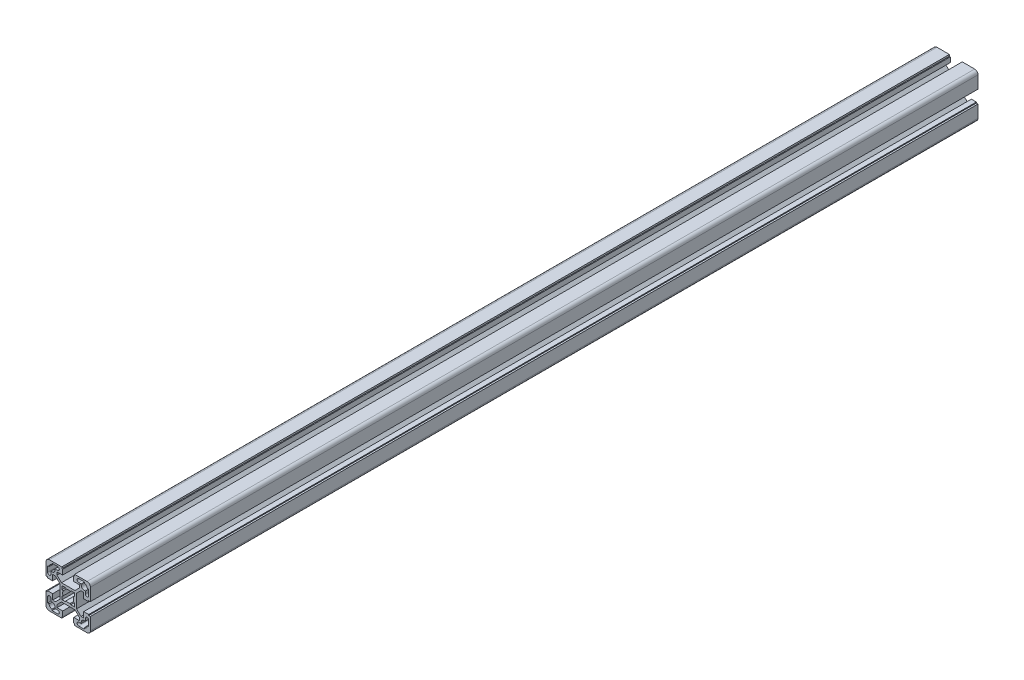
from build123d import *

# Parameters (mm, degrees)
EXTRUDE1_DEPTH = 800


with BuildPart() as part:
    # Sketch1 → Extrude1 (new body)
    with BuildSketch(Plane.XY):
        with BuildLine():
            Line((5.8, -20), (17, -20))
            ThreePointArc((17, -20), (19.121320344, -19.121320344), (20, -17))
            Line((20, -17), (20, -5.8))
            Line((20, -5.8), (18.5, -5.8))
            Line((18.5, -5.8), (18.5, -5))
            Line((18.5, -5), (14, -5))
            Line((14, -5), (14, -10.05))
            Line((14, -10.05), (11.464213562, -10.05))
            Line((11.464213562, -10.05), (7.5, -6.085786438))
            Line((7.5, -6.085786438), (7.5, 6.085786438))
            Line((7.5, 6.085786438), (11.464213562, 10.05))
            Line((11.464213562, 10.05), (14, 10.05))
            Line((14, 10.05), (14, 5))
            Line((14, 5), (18.5, 5))
            Line((18.5, 5), (18.5, 5.8))
            Line((18.5, 5.8), (20, 5.8))
            Line((20, 5.8), (20, 17))
            ThreePointArc((20, 17), (19.121320344, 19.121320344), (17, 20))
            Line((17, 20), (5.8, 20))
            Line((5.8, 20), (5.8, 18.5))
            Line((5.8, 18.5), (5, 18.5))
            Line((5, 18.5), (5, 14))
            Line((5, 14), (10.05, 14))
            Line((10.05, 14), (10.05, 11.464213562))
            Line((10.05, 11.464213562), (6.085786438, 7.5))
            Line((6.085786438, 7.5), (-6.085786438, 7.5))
            Line((-6.085786438, 7.5), (-10.05, 11.464213562))
            Line((-10.05, 11.464213562), (-10.05, 14))
            Line((-10.05, 14), (-5, 14))
            Line((-5, 14), (-5, 18.5))
            Line((-5, 18.5), (-5.8, 18.5))
            Line((-5.8, 18.5), (-5.8, 20))
            Line((-5.8, 20), (-17, 20))
            ThreePointArc((-17, 20), (-19.121320344, 19.121320344), (-20, 17))
            Line((-20, 17), (-20, 5.8))
            Line((-20, 5.8), (-18.5, 5.8))
            Line((-18.5, 5.8), (-18.5, 5))
            Line((-18.5, 5), (-14, 5))
            Line((-14, 5), (-14, 10.05))
            Line((-14, 10.05), (-11.464213562, 10.05))
            Line((-11.464213562, 10.05), (-7.5, 6.085786438))
            Line((-7.5, 6.085786438), (-7.5, -6.085786438))
            Line((-7.5, -6.085786438), (-11.464213562, -10.05))
            Line((-11.464213562, -10.05), (-14, -10.05))
            Line((-14, -10.05), (-14, -5))
            Line((-14, -5), (-18.5, -5))
            Line((-18.5, -5), (-18.5, -5.8))
            Line((-18.5, -5.8), (-20, -5.8))
            Line((-20, -5.8), (-20, -17))
            ThreePointArc((-20, -17), (-19.121320344, -19.121320344), (-17, -20))
            Line((-17, -20), (-5.8, -20))
            Line((-5.8, -20), (-5.8, -18.5))
            Line((-5.8, -18.5), (-5, -18.5))
            Line((-5, -18.5), (-5, -14))
            Line((-5, -14), (-10.05, -14))
            Line((-10.05, -14), (-10.05, -11.464213562))
            Line((-10.05, -11.464213562), (-6.085786438, -7.5))
            Line((-6.085786438, -7.5), (6.085786438, -7.5))
            Line((6.085786438, -7.5), (10.05, -11.464213562))
            Line((10.05, -11.464213562), (10.05, -14))
            Line((10.05, -14), (5, -14))
            Line((5, -14), (5, -18.5))
            Line((5, -18.5), (5.8, -18.5))
            Line((5.8, -18.5), (5.8, -20))
        make_face()
        with BuildLine():
            Line((14.5, -18.5), (9.5, -18.5))
            ThreePointArc((9.5, -18.5), (8, -17), (9.5, -15.5))
            Line((9.5, -15.5), (11.75, -15.5))
            Line((11.75, -15.5), (11.75, -14.5))
            ThreePointArc((11.75, -14.5), (12.555456352, -12.555456352), (14.5, -11.75))
            Line((14.5, -11.75), (15.5, -11.75))
            Line((15.5, -11.75), (15.5, -9.5))
            ThreePointArc((15.5, -9.5), (17, -8), (18.5, -9.5))
            Line((18.5, -9.5), (18.5, -14.5))
            Line((18.5, -14.5), (17.25, -14.5))
            ThreePointArc((17.25, -14.5), (16.444543648, -16.444543648), (14.5, -17.25))
            Line((14.5, -17.25), (14.5, -18.5))
        make_face(mode=Mode.SUBTRACT)
        with BuildLine():
            Line((18.5, 14.5), (17.25, 14.5))
            ThreePointArc((17.25, 14.5), (16.444543648, 16.444543648), (14.5, 17.25))
            Line((14.5, 17.25), (14.5, 18.5))
            Line((14.5, 18.5), (9.5, 18.5))
            ThreePointArc((9.5, 18.5), (8, 17), (9.5, 15.5))
            Line((9.5, 15.5), (11.75, 15.5))
            Line((11.75, 15.5), (11.75, 14.5))
            ThreePointArc((11.75, 14.5), (12.555456352, 12.555456352), (14.5, 11.75))
            Line((14.5, 11.75), (15.5, 11.75))
            Line((15.5, 11.75), (15.5, 9.5))
            ThreePointArc((15.5, 9.5), (17, 8), (18.5, 9.5))
            Line((18.5, 9.5), (18.5, 14.5))
        make_face(mode=Mode.SUBTRACT)
        with BuildLine():
            Line((5.5, 5.5), (2.397915762, 5.5))
            Line((2.397915762, 5.5), (1.998263135, 4.583333333))
            ThreePointArc((1.998263135, 4.583333333), (0, 5), (-1.998263135, 4.583333333))
            Line((-1.998263135, 4.583333333), (-2.397915762, 5.5))
            Line((-2.397915762, 5.5), (-5.5, 5.5))
            Line((-5.5, 5.5), (-5.5, 2.397915762))
            Line((-5.5, 2.397915762), (-4.583333333, 1.998263135))
            ThreePointArc((-4.583333333, 1.998263135), (-5, 0), (-4.583333333, -1.998263135))
            Line((-4.583333333, -1.998263135), (-5.5, -2.397915762))
            Line((-5.5, -2.397915762), (-5.5, -5.5))
            Line((-5.5, -5.5), (-2.397915762, -5.5))
            Line((-2.397915762, -5.5), (-1.998263135, -4.583333333))
            ThreePointArc((-1.998263135, -4.583333333), (0, -5), (1.998263135, -4.583333333))
            Line((1.998263135, -4.583333333), (2.397915762, -5.5))
            Line((2.397915762, -5.5), (5.5, -5.5))
            Line((5.5, -5.5), (5.5, -2.397915762))
            Line((5.5, -2.397915762), (4.583333333, -1.998263135))
            ThreePointArc((4.583333333, -1.998263135), (5, 0), (4.583333333, 1.998263135))
            Line((4.583333333, 1.998263135), (5.5, 2.397915762))
            Line((5.5, 2.397915762), (5.5, 5.5))
        make_face(mode=Mode.SUBTRACT)
        with BuildLine():
            Line((-18.5, -14.5), (-17.25, -14.5))
            ThreePointArc((-17.25, -14.5), (-16.444543648, -16.444543648), (-14.5, -17.25))
            Line((-14.5, -17.25), (-14.5, -18.5))
            Line((-14.5, -18.5), (-9.5, -18.5))
            ThreePointArc((-9.5, -18.5), (-8, -17), (-9.5, -15.5))
            Line((-9.5, -15.5), (-11.75, -15.5))
            Line((-11.75, -15.5), (-11.75, -14.5))
            ThreePointArc((-11.75, -14.5), (-12.555456352, -12.555456352), (-14.5, -11.75))
            Line((-14.5, -11.75), (-15.5, -11.75))
            Line((-15.5, -11.75), (-15.5, -9.5))
            ThreePointArc((-15.5, -9.5), (-17, -8), (-18.5, -9.5))
            Line((-18.5, -9.5), (-18.5, -14.5))
        make_face(mode=Mode.SUBTRACT)
        with BuildLine():
            Line((-14.5, 18.5), (-9.5, 18.5))
            ThreePointArc((-9.5, 18.5), (-8, 17), (-9.5, 15.5))
            Line((-9.5, 15.5), (-11.75, 15.5))
            Line((-11.75, 15.5), (-11.75, 14.5))
            ThreePointArc((-11.75, 14.5), (-12.555456352, 12.555456352), (-14.5, 11.75))
            Line((-14.5, 11.75), (-15.5, 11.75))
            Line((-15.5, 11.75), (-15.5, 9.5))
            ThreePointArc((-15.5, 9.5), (-17, 8), (-18.5, 9.5))
            Line((-18.5, 9.5), (-18.5, 14.5))
            Line((-18.5, 14.5), (-17.25, 14.5))
            ThreePointArc((-17.25, 14.5), (-16.444543648, 16.444543648), (-14.5, 17.25))
            Line((-14.5, 17.25), (-14.5, 18.5))
        make_face(mode=Mode.SUBTRACT)
    extrude(amount=EXTRUDE1_DEPTH)


solid = part.part
